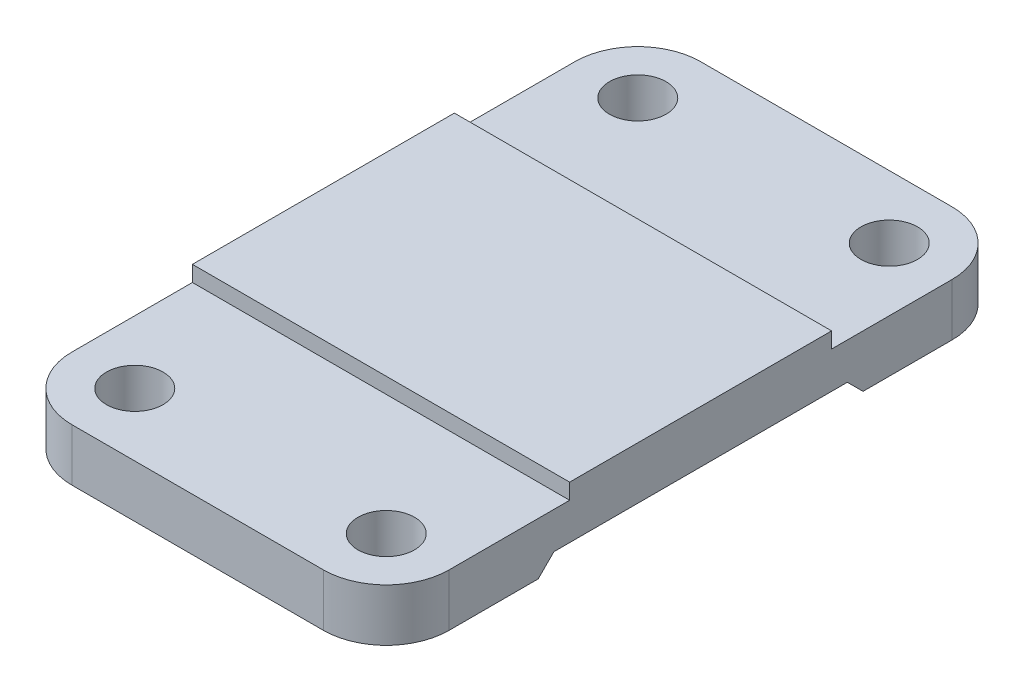
from build123d import *

# Parameters (mm, degrees)
BOSS_EXTRUDE1_DEPTH     = 36
FILLET1_R               = 12
M12X1_25_TAPPED_HOLE1_D = 10.8


with BuildPart() as part:
    # Sketch1 → Boss-Extrude1 (new, symmetric)
    with BuildSketch(Plane(origin=(0, 0, 0), x_dir=(0, 0, -1), z_dir=(1, 0, 0))):
        Polygon((-28, 3), (-31, 0), (-60, 0), (-60, 10), (-25, 10), (-25, 13), (25, 13), (25, 10), (60, 10), (60, 0), (31, 0), (28, 3), align=None)
    extrude(amount=BOSS_EXTRUDE1_DEPTH, both=True)

    # Fillet1
    fillet1_edges = [part.edges().sort_by_distance(p)[0] for p in [
        (-36, 5, 60),
        (-36, 5, -60),
        (36, 5, -60),
        (36, 5, 60),
    ]]
    fillet(fillet1_edges, radius=FILLET1_R)

    # M12x1.25 Tapped Hole1 (through all)
    with Locations(Plane(origin=(0, 10, 0), x_dir=(1, 0, 0), z_dir=(0, 1, 0))):
        with Locations((24, -48), (-24, -48), (24, 48), (-24, 48)):
            Hole(M12X1_25_TAPPED_HOLE1_D / 2)


solid = part.part
